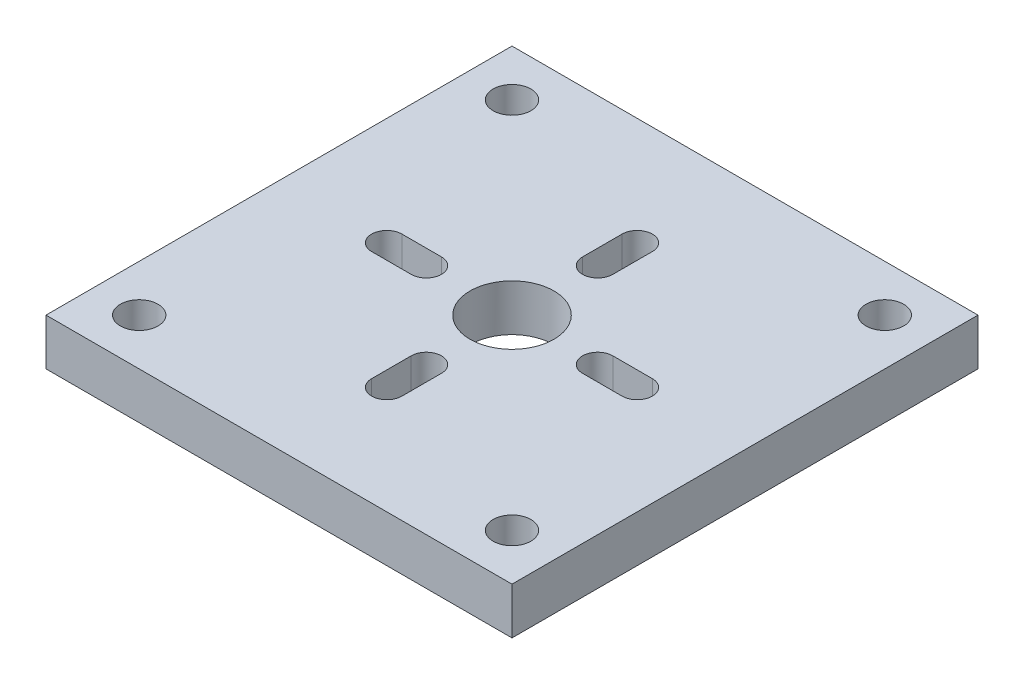
from build123d import *

# Parameters (mm, degrees)
SKETCH1_W          = 100
SKETCH1_H          = 100
BASE_DEPTH         = 10
SKETCH2_R          = 9
ACTUATOR_CUT_DEPTH = 40
CUT_EXTRUDE1_REACH = 73.414
CUT_EXTRUDE2_REACH = 73.414
SKETCH5_R          = 4.05


with BuildPart() as part:
    # Sketch1 → base (new body)
    with BuildSketch(Plane(origin=(0, 0, 0), x_dir=(1, 0, 0), z_dir=(0, 1, 0))):
        Rectangle(SKETCH1_W, SKETCH1_H)
    extrude(amount=BASE_DEPTH)

    # Sketch2 → actuator cut (cut)
    with BuildSketch(Plane(origin=(0, 10, 0), x_dir=(1, 0, 0), z_dir=(0, 1, 0))):
        with Locations(Location((0, 0, 0), (0, 0, 270))):
            Circle(SKETCH2_R)
    extrude(amount=-ACTUATOR_CUT_DEPTH, mode=Mode.SUBTRACT)

    # Sketch3 → Cut-Extrude1 (cut, up to next)
    with BuildSketch(Plane(origin=(0, 10, 0), x_dir=(1, 0, 0), z_dir=(0, 1, 0)), mode=Mode.PRIVATE) as cut_extrude1_sk1:
        with BuildLine():
            Line((3.25, -26.870057685), (3.25, -18.384776311))
            ThreePointArc((3.25, -18.384776311), (0, -15.134776311), (-3.25, -18.384776311))
            Line((-3.25, -18.384776311), (-3.25, -26.870057685))
            ThreePointArc((-3.25, -26.870057685), (0, -30.120057685), (3.25, -26.870057685))
        make_face()
    cut_extrude1_tool1 = extrude(cut_extrude1_sk1.sketch, amount=-CUT_EXTRUDE1_REACH, mode=Mode.PRIVATE) & part.part
    # Sketch3 → Cut-Extrude1 (cut, up to next)
    with BuildSketch(Plane(origin=(0, 10, 0), x_dir=(1, 0, 0), z_dir=(0, 1, 0)), mode=Mode.PRIVATE) as cut_extrude1_sk2:
        with BuildLine():
            Line((26.870057685, 3.25), (18.384776311, 3.25))
            ThreePointArc((18.384776311, 3.25), (15.134776311, 0), (18.384776311, -3.25))
            Line((18.384776311, -3.25), (26.870057685, -3.25))
            ThreePointArc((26.870057685, -3.25), (30.120057685, 0), (26.870057685, 3.25))
        make_face()
    cut_extrude1_tool2 = extrude(cut_extrude1_sk2.sketch, amount=-CUT_EXTRUDE1_REACH, mode=Mode.PRIVATE) & part.part
    # Sketch3 → Cut-Extrude1 (cut, up to next)
    with BuildSketch(Plane(origin=(0, 10, 0), x_dir=(1, 0, 0), z_dir=(0, 1, 0)), mode=Mode.PRIVATE) as cut_extrude1_sk3:
        with BuildLine():
            Line((-26.870057685, -3.25), (-18.384776311, -3.25))
            ThreePointArc((-18.384776311, -3.25), (-15.134776311, 0), (-18.384776311, 3.25))
            Line((-18.384776311, 3.25), (-26.870057685, 3.25))
            ThreePointArc((-26.870057685, 3.25), (-30.120057685, 0), (-26.870057685, -3.25))
        make_face()
    cut_extrude1_tool3 = extrude(cut_extrude1_sk3.sketch, amount=-CUT_EXTRUDE1_REACH, mode=Mode.PRIVATE) & part.part
    # Sketch3 → Cut-Extrude1 (cut, up to next)
    with BuildSketch(Plane(origin=(0, 10, 0), x_dir=(1, 0, 0), z_dir=(0, 1, 0)), mode=Mode.PRIVATE) as cut_extrude1_sk4:
        with BuildLine():
            Line((-3.25, 26.870057685), (-3.25, 18.384776311))
            ThreePointArc((-3.25, 18.384776311), (0, 15.134776311), (3.25, 18.384776311))
            Line((3.25, 18.384776311), (3.25, 26.870057685))
            ThreePointArc((3.25, 26.870057685), (0, 30.120057685), (-3.25, 26.870057685))
        make_face()
    cut_extrude1_tool4 = extrude(cut_extrude1_sk4.sketch, amount=-CUT_EXTRUDE1_REACH, mode=Mode.PRIVATE) & part.part
    add(cut_extrude1_tool1.solids().sort_by_distance((0, 10, 22.627417))[0], mode=Mode.SUBTRACT)
    add(cut_extrude1_tool2.solids().sort_by_distance((22.627417, 10, 0))[0], mode=Mode.SUBTRACT)
    add(cut_extrude1_tool3.solids().sort_by_distance((-22.627417, 10, 0))[0], mode=Mode.SUBTRACT)
    add(cut_extrude1_tool4.solids().sort_by_distance((0, 10, -22.627417))[0], mode=Mode.SUBTRACT)

    # Sketch5 → Cut-Extrude2 (cut, up to next)
    with BuildSketch(Plane(origin=(0, 10, 0), x_dir=(1, 0, 0), z_dir=(0, 1, 0)), mode=Mode.PRIVATE) as cut_extrude2_sk1:
        with Locations(Location((-40, -40, 0), (0, 0, 270))):
            Circle(SKETCH5_R)
    cut_extrude2_tool1 = extrude(cut_extrude2_sk1.sketch, amount=-CUT_EXTRUDE2_REACH, mode=Mode.PRIVATE) & part.part
    # Sketch5 → Cut-Extrude2 (cut, up to next)
    with BuildSketch(Plane(origin=(0, 10, 0), x_dir=(1, 0, 0), z_dir=(0, 1, 0)), mode=Mode.PRIVATE) as cut_extrude2_sk2:
        with Locations(Location((-40, 40, 0), (0, 0, 270))):
            Circle(SKETCH5_R)
    cut_extrude2_tool2 = extrude(cut_extrude2_sk2.sketch, amount=-CUT_EXTRUDE2_REACH, mode=Mode.PRIVATE) & part.part
    # Sketch5 → Cut-Extrude2 (cut, up to next)
    with BuildSketch(Plane(origin=(0, 10, 0), x_dir=(1, 0, 0), z_dir=(0, 1, 0)), mode=Mode.PRIVATE) as cut_extrude2_sk3:
        with Locations(Location((40, -40, 0), (0, 0, 270))):
            Circle(SKETCH5_R)
    cut_extrude2_tool3 = extrude(cut_extrude2_sk3.sketch, amount=-CUT_EXTRUDE2_REACH, mode=Mode.PRIVATE) & part.part
    # Sketch5 → Cut-Extrude2 (cut, up to next)
    with BuildSketch(Plane(origin=(0, 10, 0), x_dir=(1, 0, 0), z_dir=(0, 1, 0)), mode=Mode.PRIVATE) as cut_extrude2_sk4:
        with Locations(Location((40, 40, 0), (0, 0, 270))):
            Circle(SKETCH5_R)
    cut_extrude2_tool4 = extrude(cut_extrude2_sk4.sketch, amount=-CUT_EXTRUDE2_REACH, mode=Mode.PRIVATE) & part.part
    add(cut_extrude2_tool1.solids().sort_by_distance((-40, 10, 40))[0], mode=Mode.SUBTRACT)
    add(cut_extrude2_tool2.solids().sort_by_distance((-40, 10, -40))[0], mode=Mode.SUBTRACT)
    add(cut_extrude2_tool3.solids().sort_by_distance((40, 10, 40))[0], mode=Mode.SUBTRACT)
    add(cut_extrude2_tool4.solids().sort_by_distance((40, 10, -40))[0], mode=Mode.SUBTRACT)


solid = part.part
